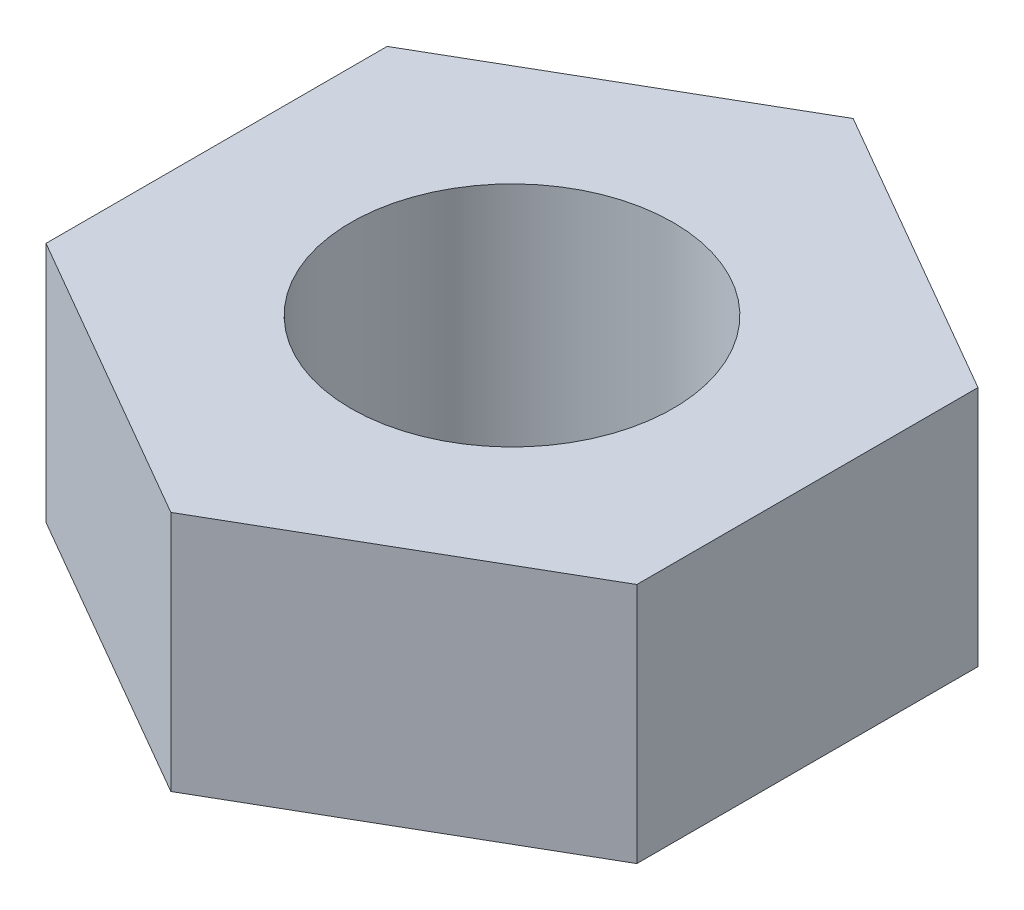
from build123d import *

# Parameters (mm, degrees)
SKETCH1_R           = 1.5
BOSS_EXTRUDE1_DEPTH = 2.25


with BuildPart() as part:
    # Sketch1 → Boss-Extrude1 (new body)
    with BuildSketch(Plane(origin=(0, 0, 0), x_dir=(1, 0, 0), z_dir=(0, 1, 0))):
        Polygon((0, 3.175426481), (-2.75, 1.58771324), (-2.75, -1.58771324), (0, -3.175426481), (2.75, -1.58771324), (2.75, 1.58771324), align=None)
        with Locations(Location((0, 0, 0), (0, 0, 270))):
            Circle(SKETCH1_R, mode=Mode.SUBTRACT)
    extrude(amount=BOSS_EXTRUDE1_DEPTH)


solid = part.part
